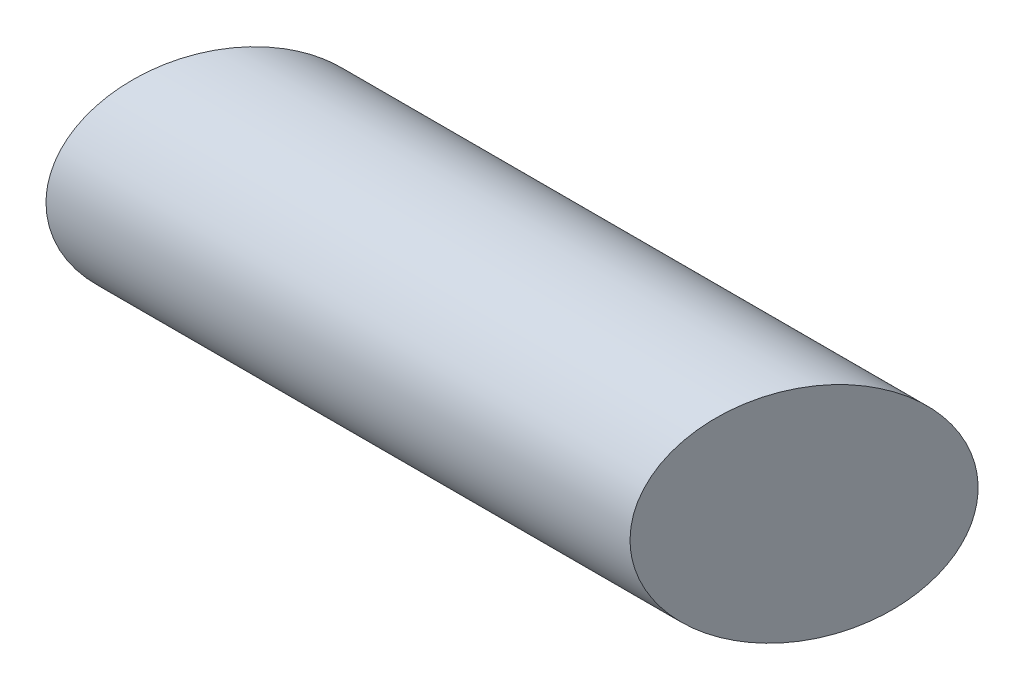
from build123d import *

# Parameters (mm, degrees)
SKETCH1_R               = 6.35
BOSS_EXTRUDE1_DEPTH     = 51.308
CUT_EXTRUDE1_DEPTH      = 53.087962755
CUT_EXTRUDE1_DEPTH_BACK = 53.087962755
CUT_EXTRUDE2_DEPTH      = 53.087962755
CUT_EXTRUDE2_DEPTH_BACK = 53.087962755


with BuildPart() as part:
    # Sketch1 → Boss-Extrude1 (new body)
    with BuildSketch(Plane(origin=(0, 0, 0), x_dir=(0, 0, -1), z_dir=(1, 0, 0))):
        Circle(SKETCH1_R)
    extrude(amount=BOSS_EXTRUDE1_DEPTH)

    # Sketch2 → Cut-Extrude1 (cut, two sides: drawn at the far end of the back side and taken through both)
    with BuildSketch(Plane(origin=(0, 0, 0), x_dir=(1, 0, 0), z_dir=(0, 1, 0)).offset(-CUT_EXTRUDE1_DEPTH_BACK)):
        Polygon((0, -6.35), (7.332348419, 6.35), (0, 6.35), align=None)
    extrude(amount=CUT_EXTRUDE1_DEPTH + CUT_EXTRUDE1_DEPTH_BACK, mode=Mode.SUBTRACT)

    # Sketch3 → Cut-Extrude2 (cut, two sides: drawn at the far end of the back side and taken through both)
    with BuildSketch(Plane(origin=(0, 0, 0), x_dir=(1, 0, 0), z_dir=(0, 1, 0)).offset(-CUT_EXTRUDE2_DEPTH_BACK)):
        Polygon((33.798828355, -6.35), (41.24323005, 6.35), (51.308, 6.35), (51.308, -6.35), align=None)
    extrude(amount=CUT_EXTRUDE2_DEPTH + CUT_EXTRUDE2_DEPTH_BACK, mode=Mode.SUBTRACT)


solid = part.part
